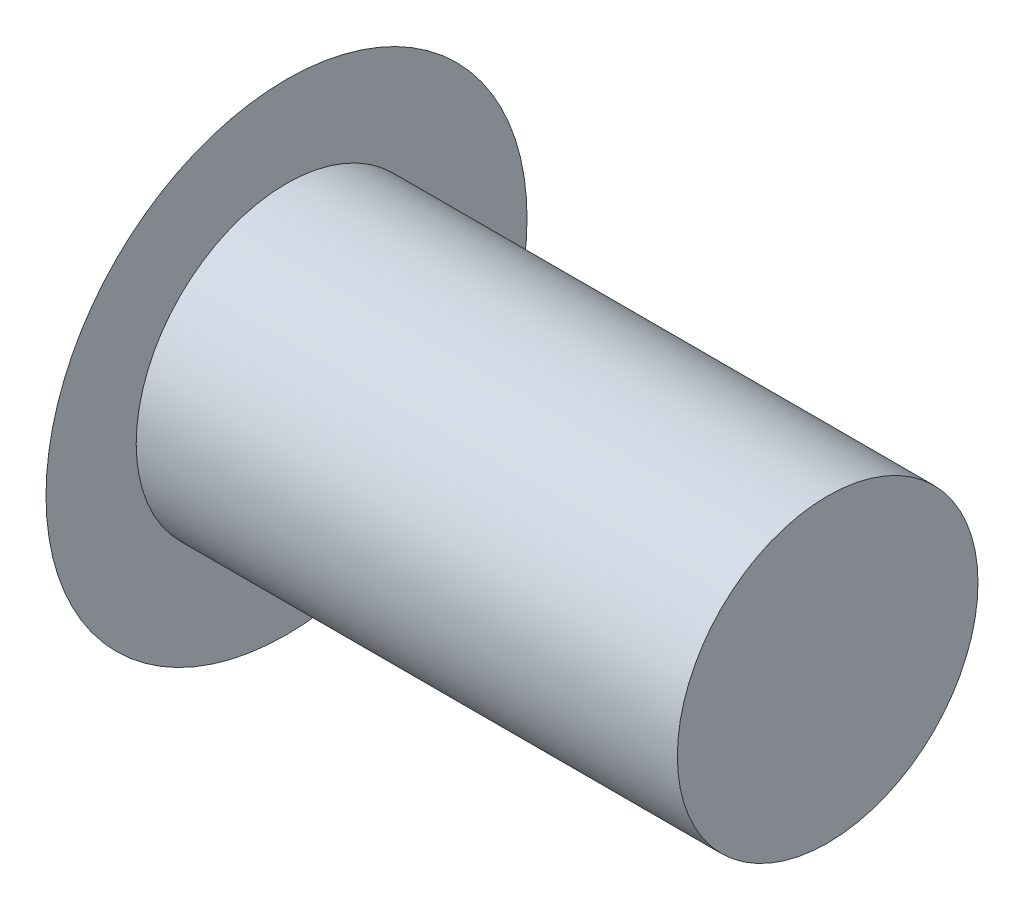
from build123d import *

# Parameters (mm, degrees)
SKETCH1_R           = 5
BOSS_EXTRUDE1_DEPTH = 18
SKETCH2_R           = 8
BOSS_EXTRUDE2_DEPTH = 3
BOSS_EXTRUDE2_TAPER = 60
CUT_EXTRUDE1_DEPTH  = 1
FILLET1_R           = 0.5


with BuildPart() as part:
    # Sketch1 → Boss-Extrude1 (new body)
    with BuildSketch(Plane(origin=(0, 0, 0), x_dir=(0, 0, -1), z_dir=(1, 0, 0))):
        Circle(SKETCH1_R)
    extrude(amount=BOSS_EXTRUDE1_DEPTH)

    # Sketch2 → Boss-Extrude2 (add)
    with BuildSketch(Plane.ZY):
        Circle(SKETCH2_R)
    extrude(amount=BOSS_EXTRUDE2_DEPTH, taper=BOSS_EXTRUDE2_TAPER)

    # Sketch4 → Cut-Extrude1 (cut)
    with BuildSketch(Plane.ZY.offset(3)):
        Polygon((2.340832904, 0), (1.170416452, 2.027220761), (-1.170416452, 2.027220761), (-2.340832904, 0), (-1.170416452, -2.027220761), (1.170416452, -2.027220761), align=None)
    extrude(amount=-CUT_EXTRUDE1_DEPTH, mode=Mode.SUBTRACT)

    # Fillet1
    fillet1_edges = [part.edges().sort_by_distance(p)[0] for p in [
        (-2, -1.01361038, 1.755624678),
        (-2, -2.027220761, 0),
        (-2, -1.01361038, -1.755624678),
        (-2, 1.01361038, -1.755624678),
        (-2, 2.027220761, 0),
        (-2, 1.01361038, 1.755624678),
    ]]
    fillet(fillet1_edges, radius=FILLET1_R)


solid = part.part
